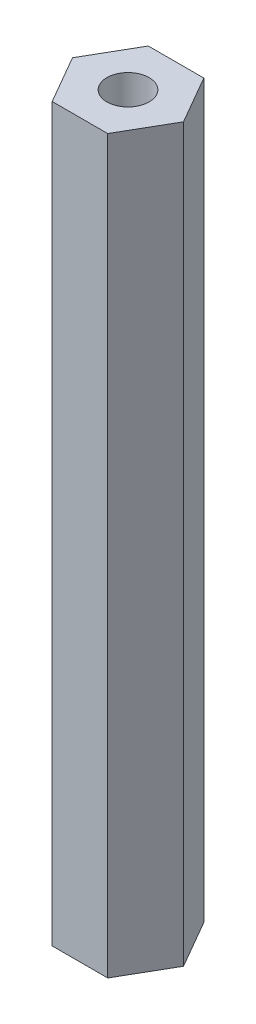
from build123d import *

# Parameters (mm, degrees)
SKETCH1_R           = 1.4224
BOSS_EXTRUDE1_DEPTH = 49.276


with BuildPart() as part:
    # Sketch1 → Boss-Extrude1 (new body)
    with BuildSketch(Plane(origin=(0, 0, 0), x_dir=(1, 0, 0), z_dir=(0, 1, 0))):
        Polygon((1.869748847, -3.2385), (3.739497694, 0), (1.869748847, 3.2385), (-1.869748847, 3.2385), (-3.739497694, 0), (-1.869748847, -3.2385), align=None)
        with Locations(Location((0, 0, 0), (0, 0, 90))):
            Circle(SKETCH1_R, mode=Mode.SUBTRACT)
    extrude(amount=BOSS_EXTRUDE1_DEPTH)


solid = part.part
